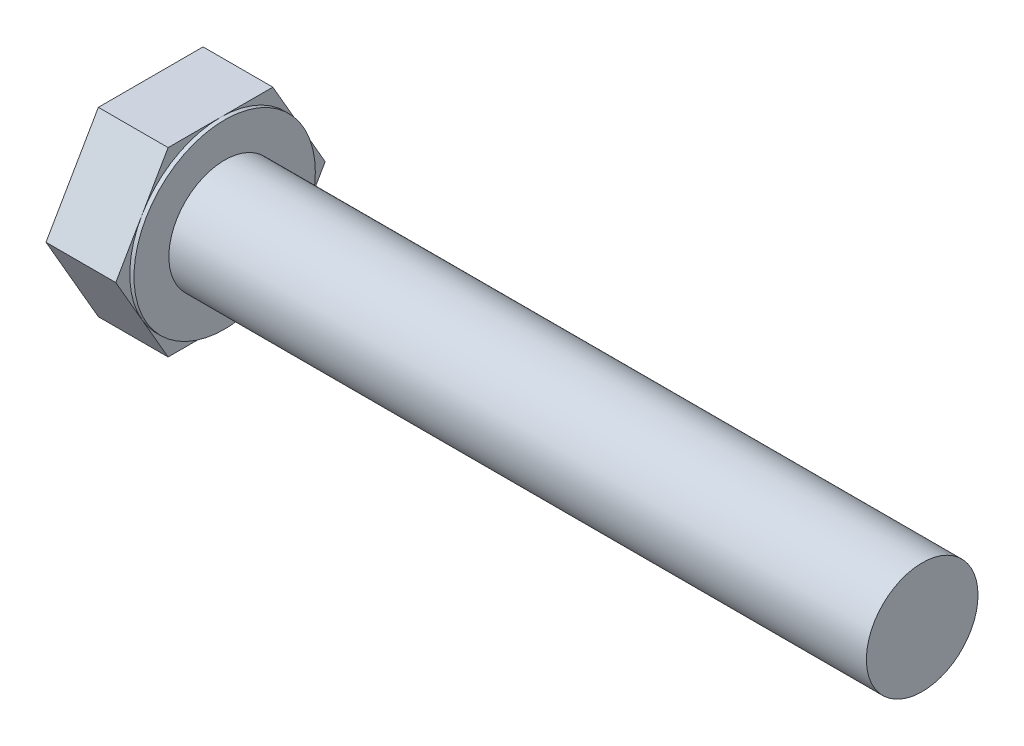
from build123d import *

# Parameters (mm, degrees)
BOSS_EXTRUDE1_DEPTH = 5
SKETCH2_R           = 6.5
BOSS_EXTRUDE2_DEPTH = 0.3
SKETCH3_R           = 4
BOSS_EXTRUDE3_DEPTH = 50


with BuildPart() as part:
    # Sketch1 → Boss-Extrude1 (new body)
    with BuildSketch(Plane(origin=(0, 0, 0), x_dir=(0, 0, -1), z_dir=(1, 0, 0))):
        Polygon((-7.505553499, 0), (-3.75277675, -6.5), (3.75277675, -6.5), (7.505553499, 0), (3.75277675, 6.5), (-3.75277675, 6.5), align=None)
    extrude(amount=-BOSS_EXTRUDE1_DEPTH)

    # Sketch2 → Boss-Extrude2 (add)
    with BuildSketch(Plane(origin=(0, 0, 0), x_dir=(0, 0, -1), z_dir=(1, 0, 0))):
        with Locations(Location((0, 0, 0), (0, 0, 150))):
            Circle(SKETCH2_R)
    extrude(amount=BOSS_EXTRUDE2_DEPTH)

    # Sketch3 → Boss-Extrude3 (add)
    with BuildSketch(Plane(origin=(0.3, 0, 0), x_dir=(0, 0, -1), z_dir=(1, 0, 0))):
        Circle(SKETCH3_R)
    extrude(amount=BOSS_EXTRUDE3_DEPTH)


solid = part.part
